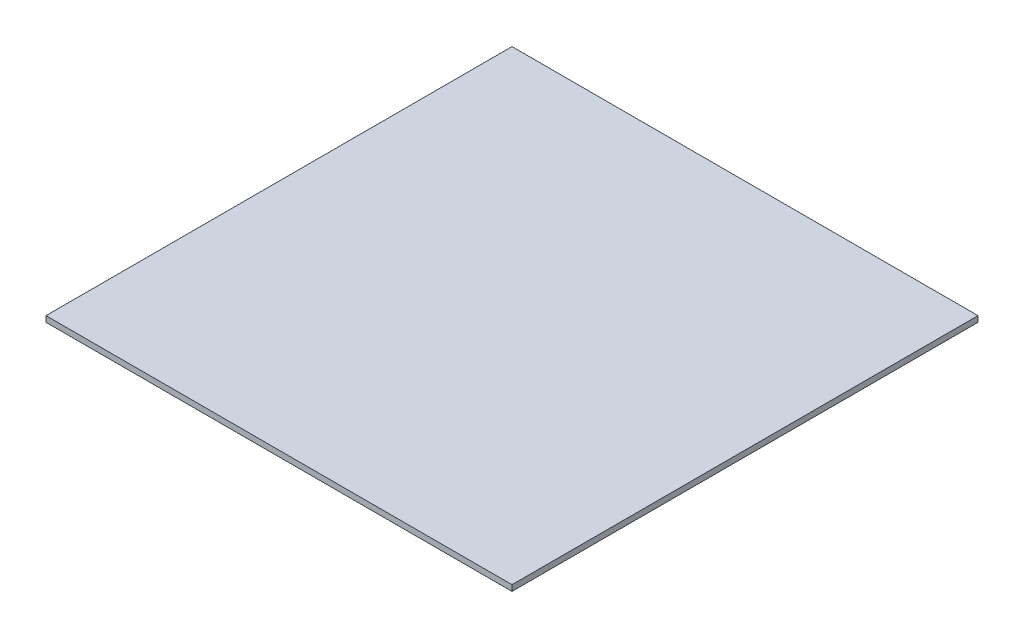
from build123d import *

# Parameters (mm, degrees)
SKETCH1_W           = 400
SKETCH1_H           = 400
BOSS_EXTRUDE1_DEPTH = 5


with BuildPart() as part:
    # Sketch1 → Boss-Extrude1 (new body)
    with BuildSketch(Plane(origin=(0, 0, 0), x_dir=(1, 0, 0), z_dir=(0, 1, 0))):
        Rectangle(SKETCH1_W, SKETCH1_H)
    extrude(amount=BOSS_EXTRUDE1_DEPTH)


solid = part.part
